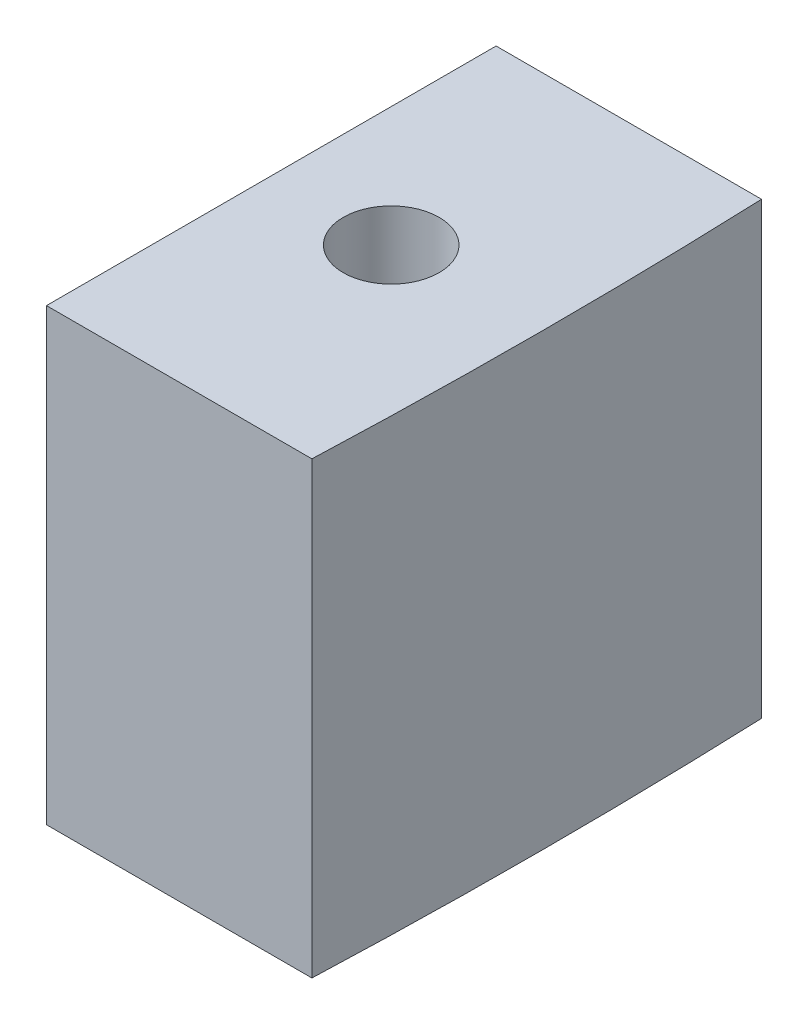
from build123d import *

# Parameters (mm, degrees)
SKETCH_1_W          = 66.89708457
SKETCH_1_H          = 15
EXTRUDE_1_DEPTH     = 15
CUT_EXTRUDE_1_REACH = 39.417
HOLE_WIZARD_M3_1_D  = 3.2
CUT_EXTRUDE_2_DEPTH = 4


with BuildPart() as part:
    # 草图1 → 凸台-拉伸1 (new body)
    with BuildSketch(Plane(origin=(0, 0, 0), x_dir=(1, 0, 0), z_dir=(0, 1, 0))):
        Rectangle(SKETCH_1_W, SKETCH_1_H)
    extrude(amount=EXTRUDE_1_DEPTH)

    # 草图2 → 切除-拉伸1 (cut, up to next)
    with BuildSketch(Plane.XZ, mode=Mode.PRIVATE) as cut_extrude_1_sk1:
        with BuildLine():
            Line((-24.593570721, 7.5), (33.448542285, 7.5))
            Line((33.448542285, 7.5), (33.448542285, -7.5))
            Line((33.448542285, -7.5), (-24.593570721, -7.5))
            ThreePointArc((-24.593570721, -7.5), (-24.448542285, 0), (-24.593570721, 7.5))
        make_face()
    cut_extrude_1_tool1 = extrude(cut_extrude_1_sk1.sketch, amount=-CUT_EXTRUDE_1_REACH, mode=Mode.PRIVATE) & part.part
    add(cut_extrude_1_tool1.solids().sort_by_distance((4.475816, 0, 0))[0], mode=Mode.SUBTRACT)

    # M3 间隙孔1 (through all)
    with Locations(Plane(origin=(0, 0, 0), x_dir=(-1, 0, 0), z_dir=(0, -1, 0))):
        with Locations((29.448542285, 0)):
            Hole(HOLE_WIZARD_M3_1_D / 2)

    # 草图5 → 切除-拉伸2 (cut)
    with BuildSketch(Plane.XZ):
        Polygon((-29.448542285, -3.348631561), (-26.548542285, -1.674315781), (-26.548542285, 1.674315781), (-29.448542285, 3.348631561), (-32.348542285, 1.674315781), (-32.348542285, -1.674315781), align=None)
    extrude(amount=-CUT_EXTRUDE_2_DEPTH, mode=Mode.SUBTRACT)


solid = part.part
